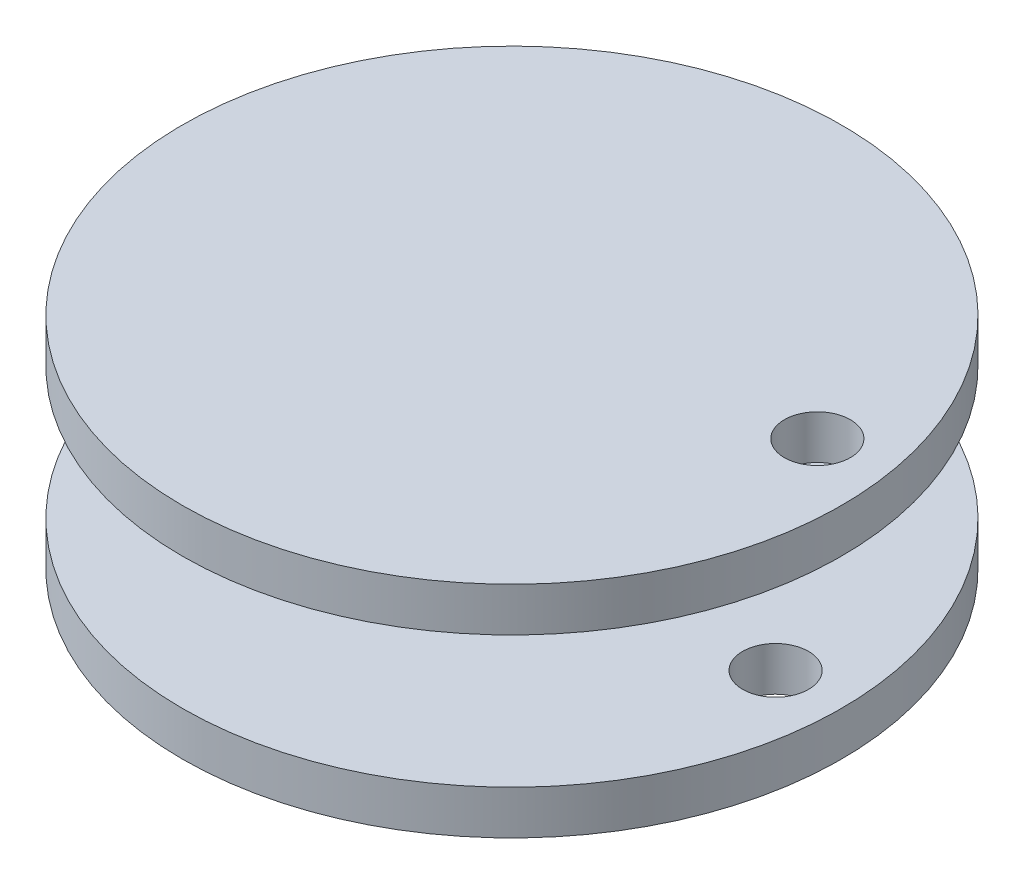
from build123d import *

# Parameters (mm, degrees)
SKETCH1_R           = 75
SKETCH1_R_2         = 7.5
BOSS_EXTRUDE1_DEPTH = 10
SKETCH2_R           = 7.5
BOSS_EXTRUDE2_DEPTH = 30
SKETCH3_R           = 75
SKETCH3_R_2         = 7.5
BOSS_EXTRUDE5_DEPTH = 10


with BuildPart() as part:
    # Sketch1 → Boss-Extrude1 (new body)
    with BuildSketch(Plane(origin=(0, 0, 0), x_dir=(1, 0, 0), z_dir=(0, 1, 0))):
        with Locations(Location((0, 0, 0), (0, 0, 270))):
            Circle(SKETCH1_R)
        with Locations(Location((60, 0, 0), (0, 0, 270))):
            Circle(SKETCH1_R_2, mode=Mode.SUBTRACT)
    extrude(amount=BOSS_EXTRUDE1_DEPTH)

    # Sketch2 → Boss-Extrude2 (add)
    with BuildSketch(Plane(origin=(0, 10, 0), x_dir=(1, 0, 0), z_dir=(0, 1, 0))):
        with Locations(Location((0, 0, 0), (0, 0, 270))):
            Circle(SKETCH2_R)
    extrude(amount=BOSS_EXTRUDE2_DEPTH)

    # Sketch3 → Boss-Extrude5 (add)
    with BuildSketch(Plane(origin=(0, 40, 0), x_dir=(1, 0, 0), z_dir=(0, 1, 0))):
        with Locations(Location((0, 0, 0), (0, 0, 270))):
            Circle(SKETCH3_R)
        with Locations(Location((59.088465181, 10.41889066, 0), (0, 0, 270))):
            Circle(SKETCH3_R_2, mode=Mode.SUBTRACT)
    extrude(amount=BOSS_EXTRUDE5_DEPTH)


solid = part.part
